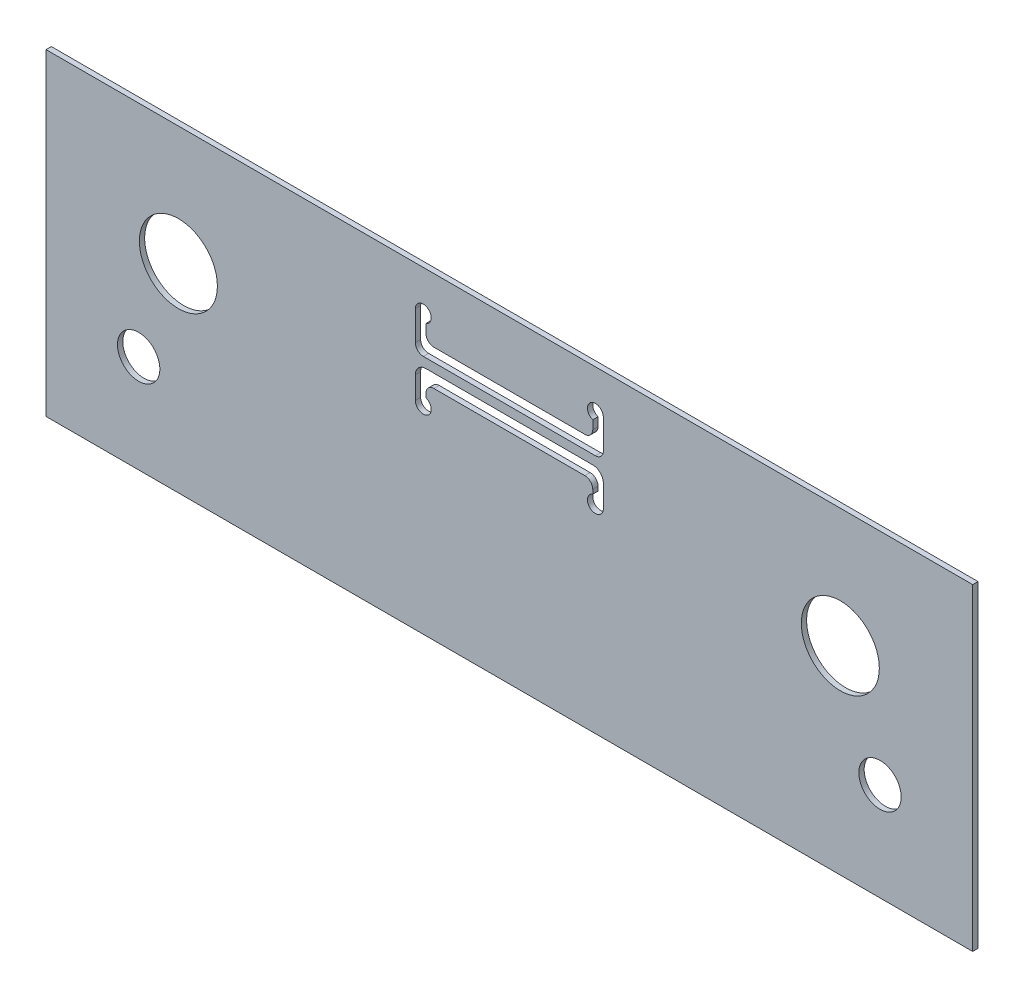
from build123d import *

# Parameters (mm, degrees)
SKETCH1_W           = 35
SKETCH1_H           = 12
SKETCH1_R           = 0.8001
SKETCH1_R_2         = 1.4732
BOSS_EXTRUDE1_DEPTH = 0.2


with BuildPart() as part:
    # Sketch1 → Boss-Extrude1 (new body)
    with BuildSketch(Plane.XY):
        with Locations((17.5, -6)):
            Rectangle(SKETCH1_W, SKETCH1_H)
        with Locations((3.5, -8.3)):
            Circle(SKETCH1_R, mode=Mode.SUBTRACT)
        with Locations((5, -4.5)):
            Circle(SKETCH1_R_2, mode=Mode.SUBTRACT)
        with Locations((30, -4.5)):
            Circle(SKETCH1_R_2, mode=Mode.SUBTRACT)
        with Locations((31.5, -8.3)):
            Circle(SKETCH1_R, mode=Mode.SUBTRACT)
        with BuildLine():
            Line((13.95, -4.5), (13.95, -3.66))
            ThreePointArc((13.95, -3.66), (14.067157288, -3.377157288), (14.35, -3.26))
            Line((14.35, -3.26), (20.65, -3.26))
            ThreePointArc((20.65, -3.26), (20.932842712, -3.377157288), (21.05, -3.66))
            Line((21.05, -3.66), (21.05, -4.5))
            ThreePointArc((21.05, -4.5), (20.576794919, -4.744948974), (20.65, -4.217157288))
            Line((20.65, -4.217157288), (20.65, -4.06))
            ThreePointArc((20.65, -4.06), (20.562132034, -3.847867966), (20.35, -3.76))
            Line((20.35, -3.76), (14.65, -3.76))
            ThreePointArc((14.65, -3.76), (14.437867966, -3.847867966), (14.35, -4.06))
            Line((14.35, -4.06), (14.35, -4.217157288))
            ThreePointArc((14.35, -4.217157288), (14.423205081, -4.744948974), (13.95, -4.5))
        make_face(mode=Mode.SUBTRACT)
        with BuildLine():
            Line((14.35, -2.11), (14.35, -1.782842712))
            ThreePointArc((14.35, -1.782842712), (14.423205081, -1.255051026), (13.95, -1.5))
            Line((13.95, -1.5), (13.95, -2.61))
            ThreePointArc((13.95, -2.61), (14.037867966, -2.822132034), (14.25, -2.91))
            Line((14.25, -2.91), (20.75, -2.91))
            ThreePointArc((20.75, -2.91), (20.962132034, -2.822132034), (21.05, -2.61))
            Line((21.05, -2.61), (21.05, -1.5))
            ThreePointArc((21.05, -1.5), (20.576794919, -1.255051026), (20.65, -1.782842712))
            Line((20.65, -1.782842712), (20.65, -2.11))
            ThreePointArc((20.65, -2.11), (20.562132034, -2.322132034), (20.35, -2.41))
            Line((20.35, -2.41), (14.65, -2.41))
            ThreePointArc((14.65, -2.41), (14.437867966, -2.322132034), (14.35, -2.11))
        make_face(mode=Mode.SUBTRACT)
    extrude(amount=BOSS_EXTRUDE1_DEPTH)


solid = part.part
